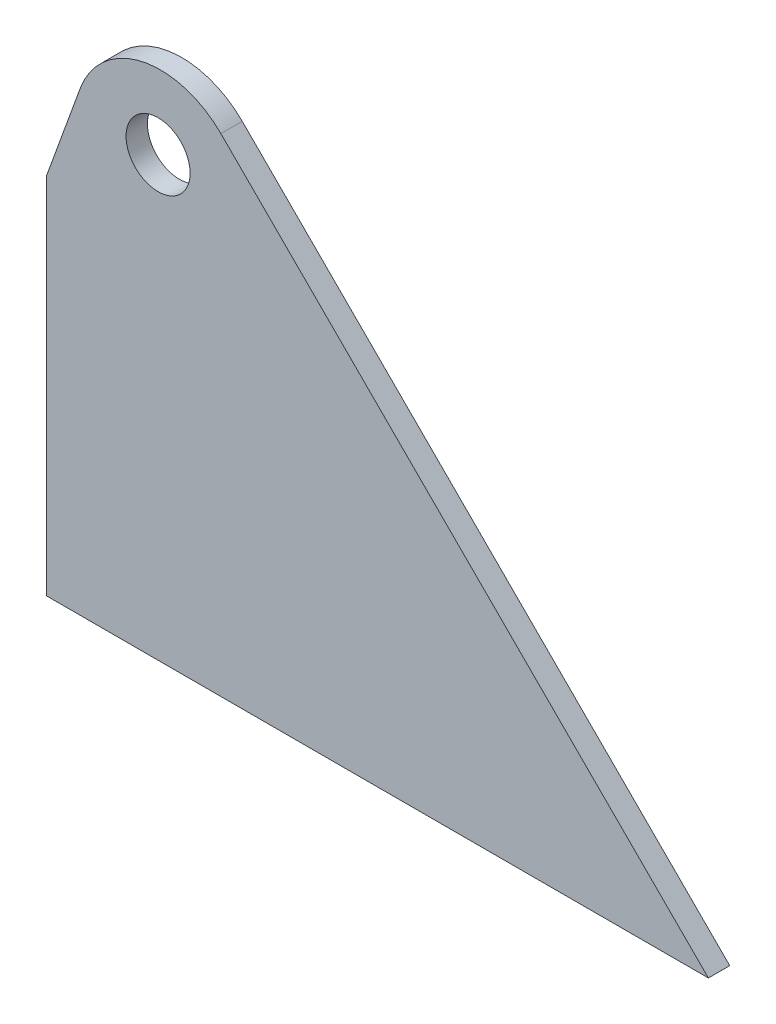
from build123d import *

# Parameters (mm, degrees)
ESQUISSE1_R        = 15
BOSS_EXTRU_1_DEPTH = 10


with BuildPart() as part:
    # Esquisse1 → Boss.-Extru.1 (new body)
    with BuildSketch(Plane.XY):
        with BuildLine():
            Line((0, 0), (0, 170))
            Line((0, 170), (15.883900487, 213.64065792))
            ThreePointArc((15.883900487, 213.64065792), (44.814020761, 239.011692472), (81.755876566, 228.244123434))
            Line((81.755876566, 228.244123434), (90, 220))
            Line((90, 220), (140, 170))
            Line((140, 170), (310, 0))
            Line((310, 0), (0, 0))
        make_face()
        with Locations((52.354231449, 205)):
            Circle(ESQUISSE1_R, mode=Mode.SUBTRACT)
    extrude(amount=BOSS_EXTRU_1_DEPTH)


solid = part.part
